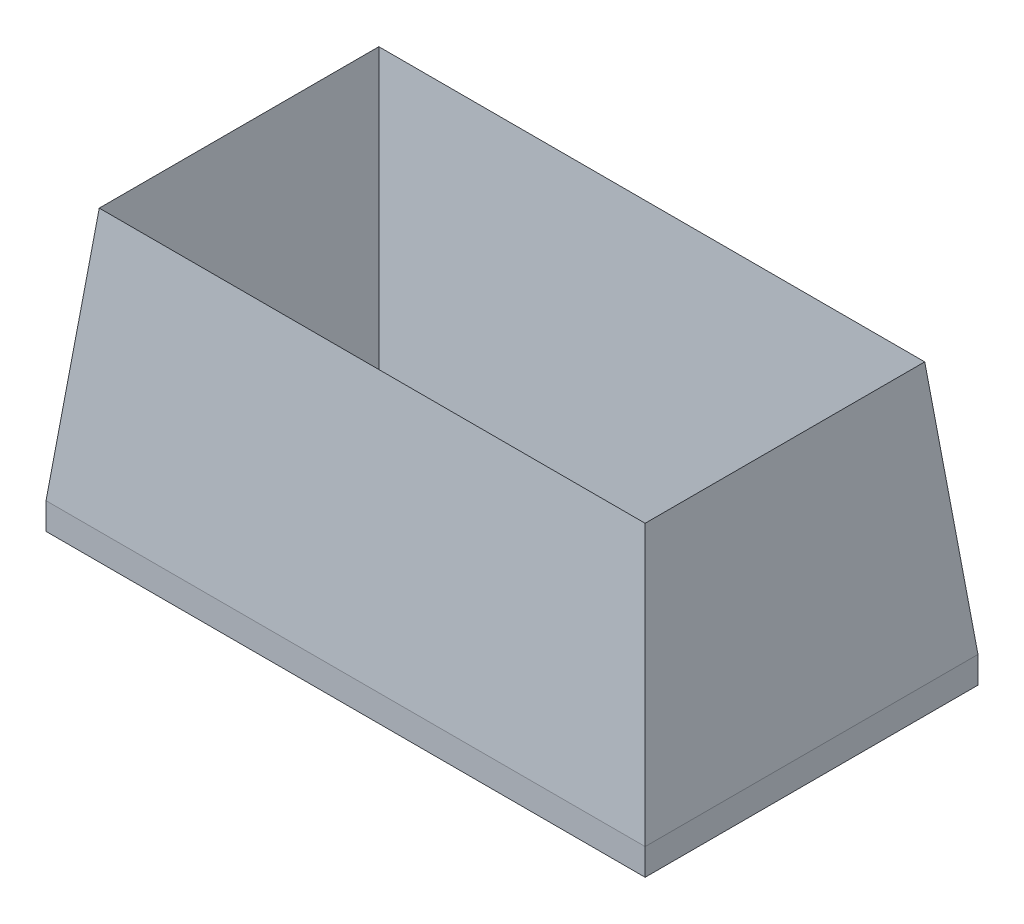
from build123d import *

# Parameters (mm, degrees)
SKETCH2_W           = 45
SKETCH2_H           = 25
BOSS_EXTRUDE1_DEPTH = 2
SKETCH3_W           = 45
SKETCH3_H           = 25
SKETCH3_W_2         = 37
SKETCH3_H_2         = 17
BOSS_EXTRUDE2_DEPTH = 35
BOSS_EXTRUDE2_TAPER = 6


with BuildPart() as part:
    # Sketch2 → Boss-Extrude1 (new body)
    with BuildSketch(Plane(origin=(0, 0, 0), x_dir=(1, 0, 0), z_dir=(0, 1, 0))):
        Rectangle(SKETCH2_W, SKETCH2_H)
    extrude(amount=BOSS_EXTRUDE1_DEPTH)

    # Sketch3 → Boss-Extrude2 (add)
    with BuildSketch(Plane(origin=(0, 2, 0), x_dir=(1, 0, 0), z_dir=(0, 1, 0))):
        Rectangle(SKETCH3_W, SKETCH3_H)
        Rectangle(SKETCH3_W_2, SKETCH3_H_2, mode=Mode.SUBTRACT)
    extrude(amount=BOSS_EXTRUDE2_DEPTH, taper=BOSS_EXTRUDE2_TAPER)


solid = part.part
